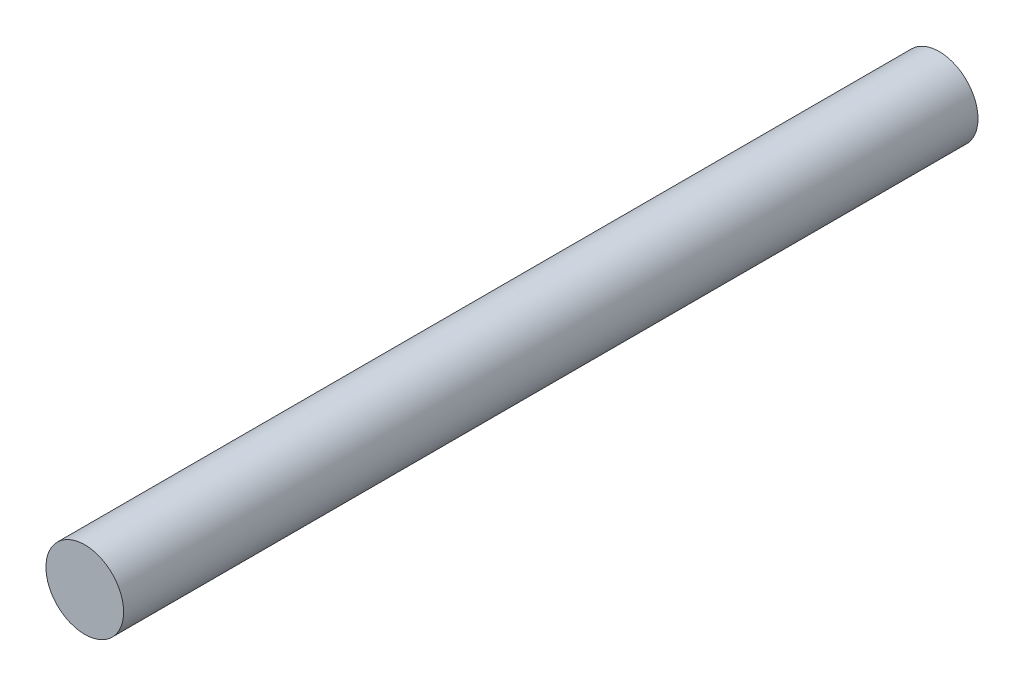
from build123d import *

# Parameters (mm, degrees)
SKETCH1_R           = 3.175
BOSS_EXTRUDE1_DEPTH = 69.85


with BuildPart() as part:
    # Sketch1 → Boss-Extrude1 (new body)
    with BuildSketch(Plane.XY):
        Circle(SKETCH1_R)
    extrude(amount=BOSS_EXTRUDE1_DEPTH)


solid = part.part
